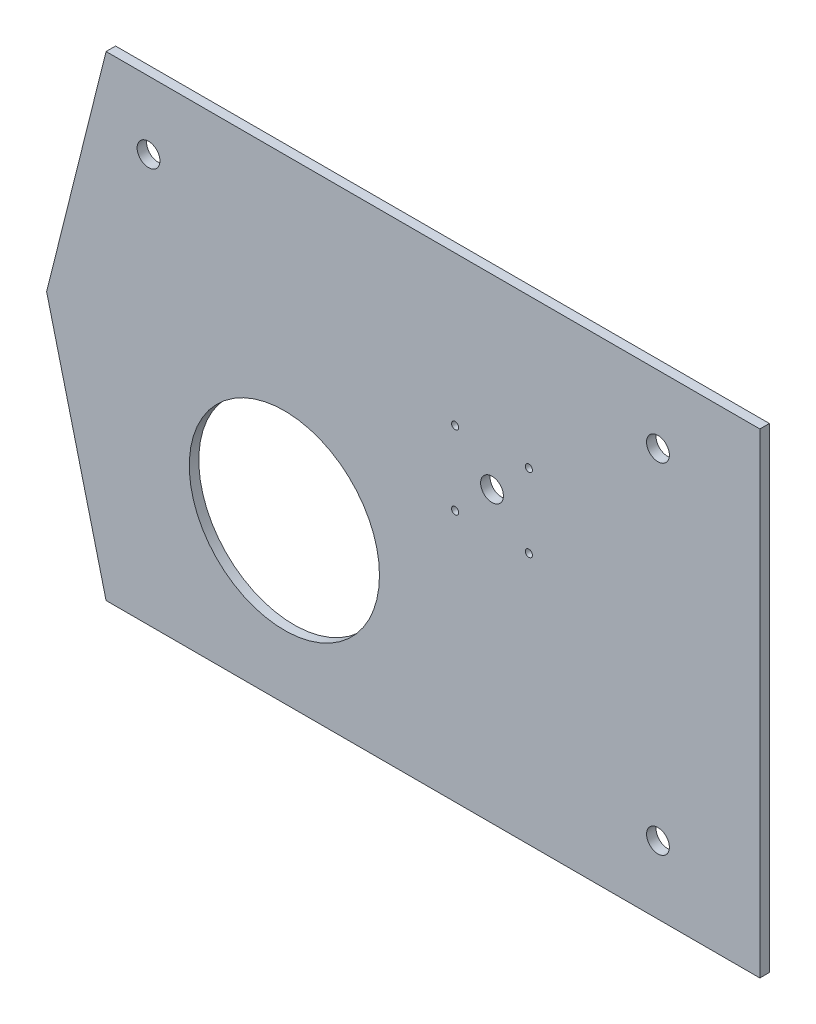
from build123d import *

# Parameters (mm, degrees)
SKETCH1_R           = 40
SKETCH1_R_2         = 4.8
SKETCH1_R_3         = 1.5
BOSS_EXTRUDE3_DEPTH = 4


with BuildPart() as part:
    # Sketch1 → Boss-Extrude3 (new body)
    with BuildSketch(Plane.XY):
        Polygon((-125, -100), (150, -100), (150, 100), (-125, 100), (-150, 0), align=None)
        with Locations((-50, -33.333333333)):
            Circle(SKETCH1_R, mode=Mode.SUBTRACT)
        with Locations((107.142857143, -71.428571429)):
            Circle(SKETCH1_R_2, mode=Mode.SUBTRACT)
        with Locations((-107.142857143, 71.428571429)):
            Circle(SKETCH1_R_2, mode=Mode.SUBTRACT)
        with Locations((21.832408692, 6.152026506)):
            Circle(SKETCH1_R_3, mode=Mode.SUBTRACT)
        with Locations((37.332408692, 21.652026506)):
            Circle(SKETCH1_R_2, mode=Mode.SUBTRACT)
        with Locations((52.832408692, 6.152026506)):
            Circle(SKETCH1_R_3, mode=Mode.SUBTRACT)
        with Locations((21.832408692, 37.152026506)):
            Circle(SKETCH1_R_3, mode=Mode.SUBTRACT)
        with Locations((52.832408692, 37.152026506)):
            Circle(SKETCH1_R_3, mode=Mode.SUBTRACT)
        with Locations((107.142857143, 71.428571429)):
            Circle(SKETCH1_R_2, mode=Mode.SUBTRACT)
    extrude(amount=BOSS_EXTRUDE3_DEPTH)


solid = part.part
